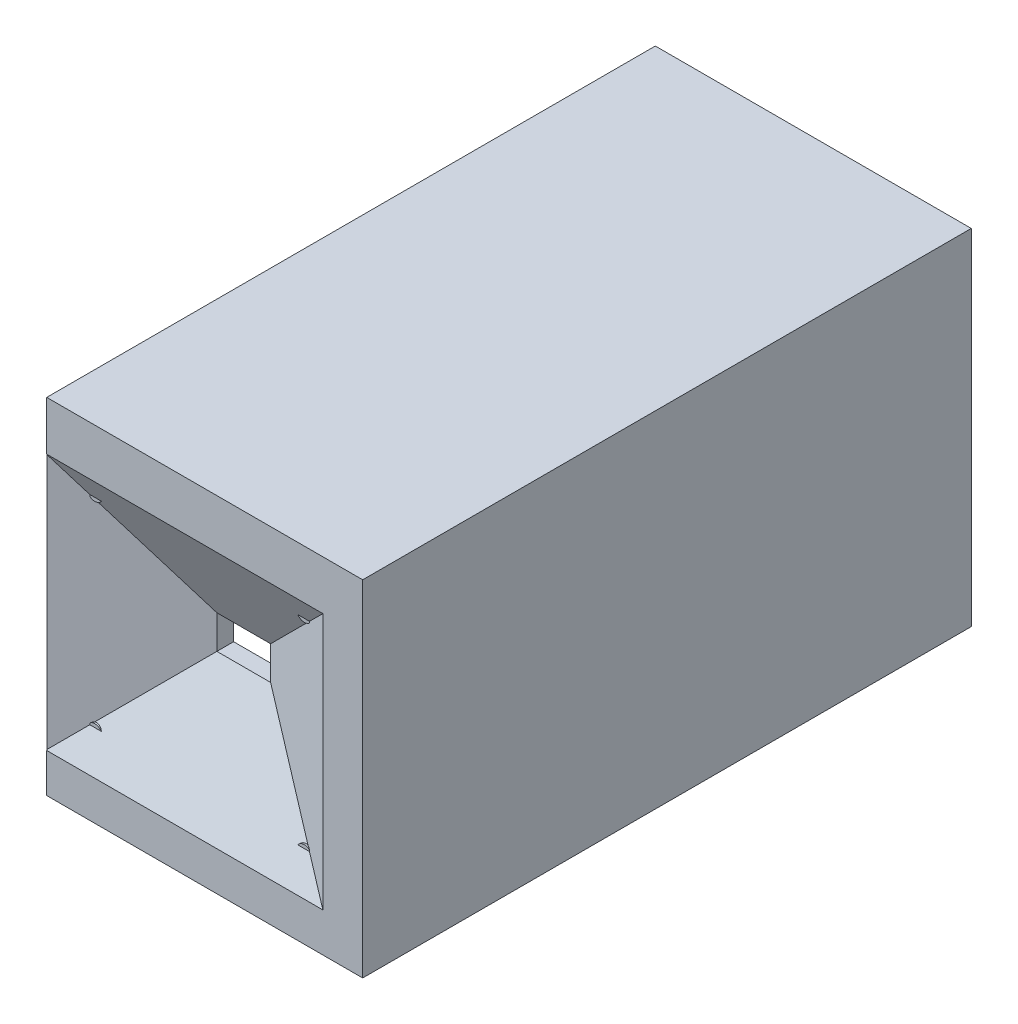
from build123d import *

# Parameters (mm, degrees)
SKETCH2_W           = 33.15
SKETCH2_H           = 33
BOSS_EXTRUDE1_DEPTH = 7.5
SKETCH3_R           = 0.762
CUT_EXTRUDE1_DEPTH  = 6
SKETCH4_W           = 5.3
SKETCH4_H           = 7
CUT_EXTRUDE2_DEPTH  = 3.4
SKETCH5_W           = 17.312690108
SKETCH5_H           = 1.808425299
CUT_EXTRUDE3_DEPTH  = 2
SKETCH6_W           = 5.3
SKETCH6_H           = 3.3
CUT_EXTRUDE4_DEPTH  = 25.560753755
CHAMFER3_SIZE       = 11
CHAMFER3_SIZE2      = 5.848803748
BOSS_EXTRUDE2_DEPTH = 52.5
SKETCH8_W           = 33.15
SKETCH8_H           = 60
BOSS_EXTRUDE3_DEPTH = 1
SKETCH9_W           = 3
SKETCH9_H           = 34
CUT_EXTRUDE5_DEPTH  = 60
SKETCH10_R          = 0.762
CUT_EXTRUDE6_DEPTH  = 6
SKETCH11_R          = 0.762
CUT_EXTRUDE7_DEPTH  = 6
SKETCH12_R          = 0.762
CUT_EXTRUDE9_DEPTH  = 7
SKETCH13_W          = 3
SKETCH13_H          = 5
CUT_EXTRUDE10_DEPTH = 1.5
SKETCH14_W          = 52.5
SKETCH14_H          = 1
BOSS_EXTRUDE4_DEPTH = 1
SKETCH15_R          = 0.762
CUT_EXTRUDE11_DEPTH = 3.5


with BuildPart() as part:
    # Sketch2 → Boss-Extrude1 (new body)
    with BuildSketch(Plane.XY):
        Rectangle(SKETCH2_W, SKETCH2_H)
    extrude(amount=BOSS_EXTRUDE1_DEPTH)

    # Sketch3 → Cut-Extrude1 (cut)
    with BuildSketch(Plane.XY):
        with Locations((10.325, 10.25)):
            Circle(SKETCH3_R)
        with Locations((-10.325, 10.25)):
            Circle(SKETCH3_R)
        with Locations((10.325, -10.25)):
            Circle(SKETCH3_R)
        with Locations((-10.325, -10.25)):
            Circle(SKETCH3_R)
    extrude(amount=CUT_EXTRUDE1_DEPTH, mode=Mode.SUBTRACT)

    # Sketch4 → Cut-Extrude2 (cut)
    with BuildSketch(Plane.XY):
        with Locations((9.775, 0)):
            Rectangle(SKETCH4_W, SKETCH4_H)
        with Locations((-9.775, 0)):
            Rectangle(SKETCH4_W, SKETCH4_H)
    extrude(amount=CUT_EXTRUDE2_DEPTH, mode=Mode.SUBTRACT)

    # Sketch5 → Cut-Extrude3 (cut)
    with BuildSketch(Plane.XY):
        with Locations((-0.109621432, -11.80915301)):
            Rectangle(SKETCH5_W, SKETCH5_H)
    extrude(amount=CUT_EXTRUDE3_DEPTH, mode=Mode.SUBTRACT)

    # Sketch6 → Cut-Extrude4 (cut, through all)
    with BuildSketch(Plane.XY):
        Rectangle(SKETCH6_W, SKETCH6_H)
    extrude(amount=CUT_EXTRUDE4_DEPTH, mode=Mode.SUBTRACT)

    # Chamfer3
    chamfer3_edges = [part.edges().sort_by_distance(p)[0] for p in [
        (2.65, 0, 7.5),
        (0, 1.65, 7.5),
        (-2.65, 0, 7.5),
        (0, -1.65, 7.5),
    ]]
    chamfer3_side = [part.faces().sort_by_distance(p)[0] for p in [
        (-16.107247662, 0, 7.5),
    ]]
    chamfer(chamfer3_edges, length=CHAMFER3_SIZE, length2=CHAMFER3_SIZE2, reference=chamfer3_side[0])

    # Sketch7 → Boss-Extrude2 (add)
    with BuildSketch(Plane.XY):
        Polygon((13.575, -16.5), (17.575, -16.5), (17.575, 16.5), (-16.575, 16.5), (-16.575, -16.5), (-13.575, -16.5), (-13.575, 13.5), (13.575, 13.5), align=None)
    extrude(amount=-BOSS_EXTRUDE2_DEPTH)

    # Sketch8 → Boss-Extrude3 (add)
    with BuildSketch(Plane(origin=(0, 16.5, 0), x_dir=(1, 0, 0), z_dir=(0, 1, 0))):
        with Locations((0, 22.5)):
            Rectangle(SKETCH8_W, SKETCH8_H)
    extrude(amount=BOSS_EXTRUDE3_DEPTH)

    # Sketch9 → Cut-Extrude5 (cut)
    with BuildSketch(Plane(origin=(0, 0, -52.5), x_dir=(-1, 0, 0), z_dir=(0, 0, -1))):
        with Locations((15.075, 0.5)):
            Rectangle(SKETCH9_W, SKETCH9_H)
    extrude(amount=-CUT_EXTRUDE5_DEPTH, mode=Mode.SUBTRACT)

    # Sketch10 → Cut-Extrude6 (cut)
    with BuildSketch(Plane.ZY.offset(13.575)):
        with Locations((-44, 15.5)):
            Circle(SKETCH10_R)
        with Locations(Location((5, 11, 0), (0, 0, 180))):
            Circle(SKETCH10_R)
        with Locations((5, -10)):
            Circle(SKETCH10_R)
    extrude(amount=-CUT_EXTRUDE6_DEPTH, mode=Mode.SUBTRACT)

    # Sketch11 → Cut-Extrude7 (cut)
    with BuildSketch(Plane(origin=(0, -16.5, 0), x_dir=(-1, 0, 0), z_dir=(0, -1, 0))):
        with Locations(Location((-15.575, 44, 0), (0, 0, 90))):
            Circle(SKETCH11_R)
        with Locations((-15.575, -51.5)):
            Circle(SKETCH11_R)
        with Locations(Location((7.075, -4.5, 0), (0, 0, 90))):
            Circle(SKETCH11_R)
        with Locations(Location((-11.075, -4.5, 0), (0, 0, 90))):
            Circle(SKETCH11_R)
    extrude(amount=-CUT_EXTRUDE7_DEPTH, mode=Mode.SUBTRACT)

    # Sketch12 → Cut-Extrude9 (cut)
    with BuildSketch(Plane(origin=(0, 0, -52.5), x_dir=(-1, 0, 0), z_dir=(0, 0, -1))):
        with Locations((-15.575, 15.5)):
            Circle(SKETCH12_R)
        with Locations((-15.575, -14.5)):
            Circle(SKETCH12_R)
        with Locations((11.575, 15.5)):
            Circle(SKETCH12_R)
    extrude(amount=-CUT_EXTRUDE9_DEPTH, mode=Mode.SUBTRACT)

    # Sketch13 → Cut-Extrude10 (cut)
    with BuildSketch(Plane.ZY.offset(-13.575)):
        Polygon((-46.5, 7), (-52.5, 7), (-52.5, -13), (-46.5, -13), (-46.5, -8), align=None)
        with Locations((-45, -10.5)):
            Rectangle(SKETCH13_W, SKETCH13_H)
    extrude(amount=-CUT_EXTRUDE10_DEPTH, mode=Mode.SUBTRACT)

    # Sketch14 → Boss-Extrude4 (add)
    with BuildSketch(Plane(origin=(16.575, 0, 0), x_dir=(0, 0, -1), z_dir=(1, 0, 0))):
        Polygon((0, 17.5), (-7.5, 17.5), (-7.5, -16.5), (0, -16.5), (0, 16.5), align=None)
        with Locations((26.25, 17)):
            Rectangle(SKETCH14_W, SKETCH14_H)
    extrude(amount=BOSS_EXTRUDE4_DEPTH)

    # Sketch15 → Cut-Extrude11 (cut)
    with BuildSketch(Plane.XZ.offset(-13.5)):
        with Locations(Location((-10.813, -7.538, 0), (0, 0, 270))):
            Circle(SKETCH15_R)
        with Locations(Location((10.677, -22.458, 0), (0, 0, 270))):
            Circle(SKETCH15_R)
    extrude(amount=-CUT_EXTRUDE11_DEPTH, mode=Mode.SUBTRACT)


solid = part.part
